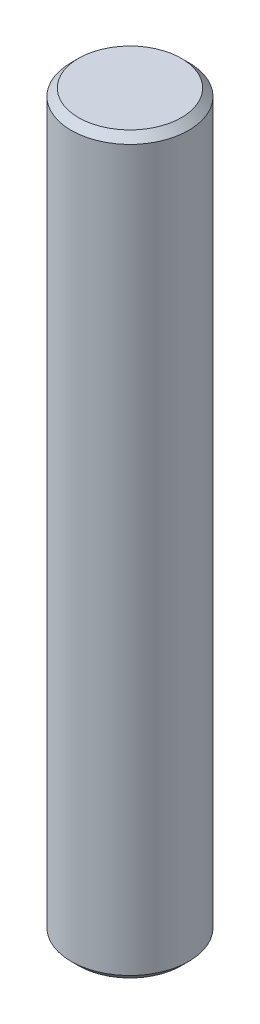
from build123d import *

# Parameters (mm, degrees)
SKETCH_1_R      = 8
EXTRUDE_1_DEPTH = 100
CHAMFER_1_SIZE  = 1


with BuildPart() as part:
    # 草图1 → 凸台-拉伸1 (new body)
    with BuildSketch(Plane(origin=(0, 0, 0), x_dir=(1, 0, 0), z_dir=(0, 1, 0))):
        with Locations(Location((0, 0, 0), (0, 0, 270))):
            Circle(SKETCH_1_R)
    extrude(amount=EXTRUDE_1_DEPTH)

    # 倒角1
    chamfer_1_edges = [part.edges().sort_by_distance(p)[0] for p in [
        (0, 0, -8),
        (0, 100, -8),
    ]]
    chamfer(chamfer_1_edges, length=CHAMFER_1_SIZE)


solid = part.part
